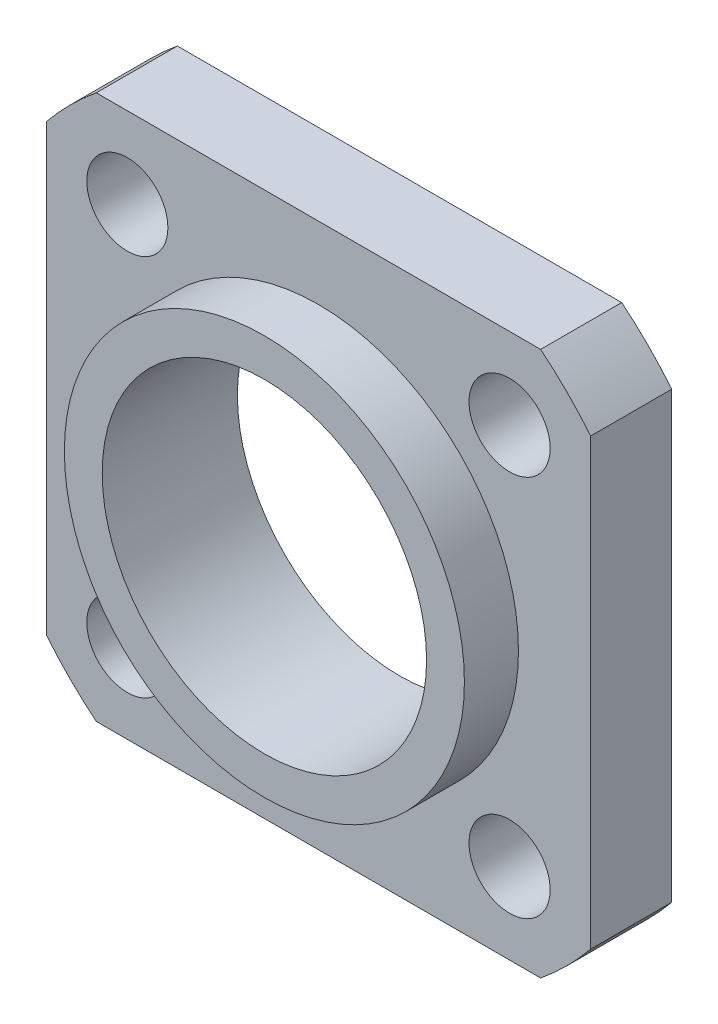
from build123d import *

# Parameters (mm, degrees)
SKETCH_1_R          = 13
SKETCH_1_R_2        = 6
SKETCH_1_R_3        = 1.5
EXTRUDE_1_DEPTH     = 3
SKETCH_2_R          = 7.4
SKETCH_2_R_2        = 6
EXTRUDE_2_DEPTH     = 2
CUT_EXTRUDE_START   = -41
CUT_EXTRUDE_1_DEPTH = 41


with BuildPart() as part:
    # 草图1 → 凸台-拉伸1 (new body)
    with BuildSketch(Plane.XY):
        Circle(SKETCH_1_R)
        Circle(SKETCH_1_R_2, mode=Mode.SUBTRACT)
        with Locations((-7.071067812, 7.071067812)):
            Circle(SKETCH_1_R_3, mode=Mode.SUBTRACT)
        with Locations((7.071067812, 7.071067812)):
            Circle(SKETCH_1_R_3, mode=Mode.SUBTRACT)
        with Locations((7.071067812, -7.071067812)):
            Circle(SKETCH_1_R_3, mode=Mode.SUBTRACT)
        with Locations((-7.071067812, -7.071067812)):
            Circle(SKETCH_1_R_3, mode=Mode.SUBTRACT)
    extrude(amount=EXTRUDE_1_DEPTH)

    # 草图2 → 凸台-拉伸2 (add)
    with BuildSketch(Plane.XY.offset(3)):
        Circle(SKETCH_2_R)
        Circle(SKETCH_2_R_2, mode=Mode.SUBTRACT)
    extrude(amount=EXTRUDE_2_DEPTH)

    # 草图3 → 切除-拉伸1 (cut)
    with BuildSketch(Plane.XY.offset(3).offset(CUT_EXTRUDE_START)):
        with BuildLine():
            Line((-8.220315878, 10.071067812), (8.220315878, 10.071067812))
            ThreePointArc((8.220315878, 10.071067812), (0, 13), (-8.220315878, 10.071067812))
        make_face()
        with BuildLine():
            Line((10.071067812, 8.220315878), (10.071067812, -8.220315878))
            ThreePointArc((10.071067812, -8.220315878), (13, 0), (10.071067812, 8.220315878))
        make_face()
        with BuildLine():
            Line((8.220315878, -10.071067812), (-8.220315878, -10.071067812))
            ThreePointArc((-8.220315878, -10.071067812), (0, -13), (8.220315878, -10.071067812))
        make_face()
        with BuildLine():
            Line((-10.071067812, -8.220315878), (-10.071067812, 8.220315878))
            ThreePointArc((-10.071067812, 8.220315878), (-13, 0), (-10.071067812, -8.220315878))
        make_face()
    extrude(amount=CUT_EXTRUDE_1_DEPTH, mode=Mode.SUBTRACT)


solid = part.part
